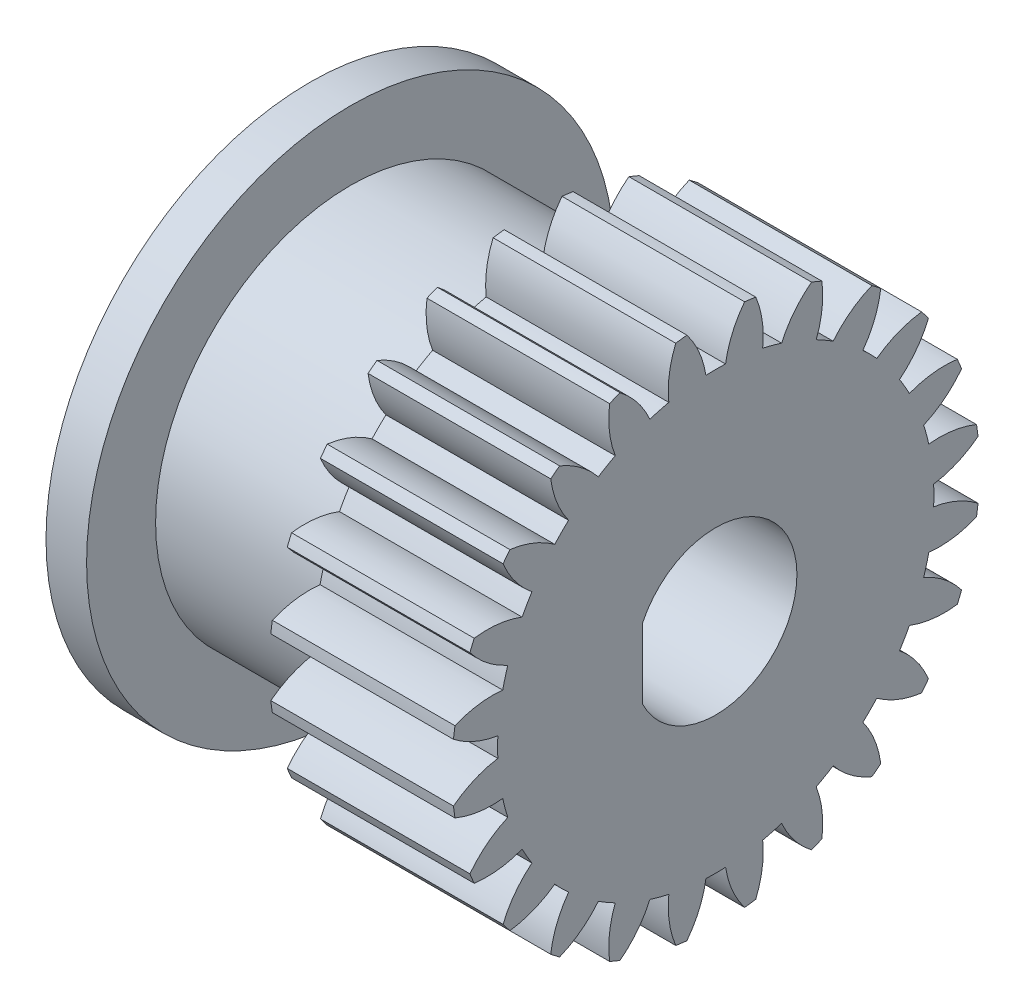
from build123d import *

# Parameters (mm, degrees)
CUT_EXTRUDE_1_REACH  = 15.583
CUT_EXTRUDE_2_REACH  = 15.583
CUT_EXTRUDE_3_REACH  = 15.583
CUT_EXTRUDE_4_REACH  = 15.583
CUT_EXTRUDE_5_REACH  = 15.583
CUT_EXTRUDE_6_REACH  = 15.583
CUT_EXTRUDE_7_REACH  = 15.583
CUT_EXTRUDE_8_REACH  = 15.583
CUT_EXTRUDE_9_REACH  = 15.583
CUT_EXTRUDE_10_REACH = 15.583
CUT_EXTRUDE_11_REACH = 15.583
CUT_EXTRUDE_12_REACH = 15.583
CUT_EXTRUDE_13_REACH = 15.583
CUT_EXTRUDE_14_REACH = 15.583
CUT_EXTRUDE_15_REACH = 15.583
CUT_EXTRUDE_16_REACH = 15.583
CUT_EXTRUDE_17_REACH = 15.583
CUT_EXTRUDE_18_REACH = 15.583
CUT_EXTRUDE_19_REACH = 15.583
CUT_EXTRUDE_20_REACH = 15.583
CUT_EXTRUDE_21_REACH = 15.583
CUT_EXTRUDE_22_REACH = 15.583
CUT_EXTRUDE_23_REACH = 15.583
CUT_EXTRUDE_24_REACH = 15.583
CUT_EXTRUDE_25_DEPTH = 14.583077707


with BuildPart() as part:
    # 草图1 → 旋转1 (revolve)
    with BuildSketch(Plane(origin=(0, 0, 0), x_dir=(-1, 0, 0), z_dir=(0, 0, -1)), mode=Mode.PRIVATE) as revolve_1_sk:
        Polygon((-4.5, 6.5), (-4.5, 0), (5.5, 0), (5.5, 6.5), (4.5, 6.5), (4.5, 4.8), (0, 4.8), (0, 6.5), align=None)
    revolve(revolve_1_sk.sketch.rotate(Axis((4.5, 0, 0), (-1, 0, 0)), 270), axis=Axis((4.5, 0, 0), (-1, 0, 0)))

    # 草图2 → 切除-拉伸1 (cut, up to next)
    with BuildSketch(Plane(origin=(4.5, 0, 0), x_dir=(0, 0, -1), z_dir=(1, 0, 0)), mode=Mode.PRIVATE) as cut_extrude_1_sk1:
        with BuildLine():
            ThreePointArc((-6.056700011, 2.359318752), (-6.278517871, 1.682323793), (-6.424915449, 0.98512003))
            ThreePointArc((-6.424915449, 0.98512003), (-5.84730165, 1.144628565), (-5.248177569, 1.156074481))
            ThreePointArc((-5.248177569, 1.156074481), (-5.19088539, 1.390893548), (-5.123092339, 1.622898915))
            ThreePointArc((-5.123092339, 1.622898915), (-5.636226055, 1.93237341), (-6.056700011, 2.359318752))
        make_face()
    cut_extrude_1_tool1 = extrude(cut_extrude_1_sk1.sketch, amount=-CUT_EXTRUDE_1_REACH, mode=Mode.PRIVATE) & part.part
    add(cut_extrude_1_tool1.solids().sort_by_distance((4.5, 1.561612, 5.828016))[0], mode=Mode.SUBTRACT)

    # 草图3 → 切除-拉伸2 (cut, up to next)
    with BuildSketch(Plane(origin=(4.5, 0, 0), x_dir=(0, 0, -1), z_dir=(1, 0, 0)), mode=Mode.PRIVATE) as cut_extrude_2_sk1:
        with BuildLine():
            ThreePointArc((-5.239686336, 3.846516229), (-5.629165125, 3.25), (-5.951023938, 2.614443361))
            ThreePointArc((-5.951023938, 2.614443361), (-5.351808006, 2.619019322), (-4.770136161, 2.475010506))
            ThreePointArc((-4.770136161, 2.475010506), (-4.65402052, 2.687), (-4.528490053, 2.893553842))
            ThreePointArc((-4.528490053, 2.893553842), (-4.944041268, 3.325292028), (-5.239686336, 3.846516229))
        make_face()
    cut_extrude_2_tool1 = extrude(cut_extrude_2_sk1.sketch, amount=-CUT_EXTRUDE_2_REACH, mode=Mode.PRIVATE) & part.part
    add(cut_extrude_2_tool1.solids().sort_by_distance((4.5, 3.016803, 5.225256))[0], mode=Mode.SUBTRACT)

    # 草图4 → 切除-拉伸3 (cut, up to next)
    with BuildSketch(Plane(origin=(4.5, 0, 0), x_dir=(0, 0, -1), z_dir=(1, 0, 0)), mode=Mode.PRIVATE) as cut_extrude_3_sk1:
        with BuildLine():
            ThreePointArc((-4.065596697, 5.071579981), (-4.596194078, 4.596194078), (-5.071579981, 4.065596697))
            ThreePointArc((-5.071579981, 4.065596697), (-4.49159749, 3.91492824), (-3.967017857, 3.625278654))
            ThreePointArc((-3.967017857, 3.625278654), (-3.799991842, 3.799991842), (-3.625278654, 3.967017857))
            ThreePointArc((-3.625278654, 3.967017857), (-3.91492824, 4.49159749), (-4.065596697, 5.071579981))
        make_face()
    cut_extrude_3_tool1 = extrude(cut_extrude_3_sk1.sketch, amount=-CUT_EXTRUDE_3_REACH, mode=Mode.PRIVATE) & part.part
    add(cut_extrude_3_tool1.solids().sort_by_distance((4.5, 4.266404, 4.266404))[0], mode=Mode.SUBTRACT)

    # 草图5 → 切除-拉伸4 (cut, up to next)
    with BuildSketch(Plane(origin=(4.5, 0, 0), x_dir=(0, 0, -1), z_dir=(1, 0, 0)), mode=Mode.PRIVATE) as cut_extrude_4_sk1:
        with BuildLine():
            ThreePointArc((-3.846516229, 5.239686336), (-3.325292028, 4.944041268), (-2.893553842, 4.528490053))
            ThreePointArc((-2.893553842, 4.528490053), (-2.687, 4.65402052), (-2.475010506, 4.770136161))
            ThreePointArc((-2.475010506, 4.770136161), (-2.619019322, 5.351808006), (-2.614443361, 5.951023938))
            ThreePointArc((-2.614443361, 5.951023938), (-3.25, 5.629165125), (-3.846516229, 5.239686336))
        make_face()
    cut_extrude_4_tool1 = extrude(cut_extrude_4_sk1.sketch, amount=-CUT_EXTRUDE_4_REACH, mode=Mode.PRIVATE) & part.part
    add(cut_extrude_4_tool1.solids().sort_by_distance((4.5, 5.225256, 3.016803))[0], mode=Mode.SUBTRACT)

    # 草图6 → 切除-拉伸5 (cut, up to next)
    with BuildSketch(Plane(origin=(4.5, 0, 0), x_dir=(0, 0, -1), z_dir=(1, 0, 0)), mode=Mode.PRIVATE) as cut_extrude_5_sk1:
        with BuildLine():
            ThreePointArc((-2.359318752, 6.056700011), (-1.93237341, 5.636226055), (-1.622898915, 5.123092339))
            ThreePointArc((-1.622898915, 5.123092339), (-1.390893548, 5.19088539), (-1.156074481, 5.248177569))
            ThreePointArc((-1.156074481, 5.248177569), (-1.144628565, 5.84730165), (-0.98512003, 6.424915449))
            ThreePointArc((-0.98512003, 6.424915449), (-1.682323793, 6.278517871), (-2.359318752, 6.056700011))
        make_face()
    cut_extrude_5_tool1 = extrude(cut_extrude_5_sk1.sketch, amount=-CUT_EXTRUDE_5_REACH, mode=Mode.PRIVATE) & part.part
    add(cut_extrude_5_tool1.solids().sort_by_distance((4.5, 5.828016, 1.561612))[0], mode=Mode.SUBTRACT)

    # 草图7 → 切除-拉伸6 (cut, up to next)
    with BuildSketch(Plane(origin=(4.5, 0, 0), x_dir=(0, 0, -1), z_dir=(1, 0, 0)), mode=Mode.PRIVATE) as cut_extrude_6_sk1:
        with BuildLine():
            ThreePointArc((0.711337602, 6.460959589), (0, 6.5), (-0.711337602, 6.460959589))
            ThreePointArc((-0.711337602, 6.460959589), (-0.407766737, 5.94431135), (-0.241646108, 5.368564348))
            ThreePointArc((-0.241646108, 5.368564348), (0, 5.374), (0.241646108, 5.368564348))
            ThreePointArc((0.241646108, 5.368564348), (0.407766737, 5.94431135), (0.711337602, 6.460959589))
        make_face()
    cut_extrude_6_tool1 = extrude(cut_extrude_6_sk1.sketch, amount=-CUT_EXTRUDE_6_REACH, mode=Mode.PRIVATE) & part.part
    add(cut_extrude_6_tool1.solids().sort_by_distance((4.5, 6.033606, 0))[0], mode=Mode.SUBTRACT)

    # 草图8 → 切除-拉伸7 (cut, up to next)
    with BuildSketch(Plane(origin=(4.5, 0, 0), x_dir=(0, 0, -1), z_dir=(1, 0, 0)), mode=Mode.PRIVATE) as cut_extrude_7_sk1:
        with BuildLine():
            ThreePointArc((2.359318752, 6.056700011), (1.682323793, 6.278517871), (0.98512003, 6.424915449))
            ThreePointArc((0.98512003, 6.424915449), (1.144628565, 5.84730165), (1.156074481, 5.248177569))
            ThreePointArc((1.156074481, 5.248177569), (1.390893548, 5.19088539), (1.622898915, 5.123092339))
            ThreePointArc((1.622898915, 5.123092339), (1.93237341, 5.636226055), (2.359318752, 6.056700011))
        make_face()
    cut_extrude_7_tool1 = extrude(cut_extrude_7_sk1.sketch, amount=-CUT_EXTRUDE_7_REACH, mode=Mode.PRIVATE) & part.part
    add(cut_extrude_7_tool1.solids().sort_by_distance((4.5, 5.828016, -1.561612))[0], mode=Mode.SUBTRACT)

    # 草图9 → 切除-拉伸8 (cut, up to next)
    with BuildSketch(Plane(origin=(4.5, 0, 0), x_dir=(0, 0, -1), z_dir=(1, 0, 0)), mode=Mode.PRIVATE) as cut_extrude_8_sk1:
        with BuildLine():
            ThreePointArc((3.846516229, 5.239686336), (3.25, 5.629165125), (2.614443361, 5.951023938))
            ThreePointArc((2.614443361, 5.951023938), (2.619019322, 5.351808006), (2.475010506, 4.770136161))
            ThreePointArc((2.475010506, 4.770136161), (2.687, 4.65402052), (2.893553842, 4.528490053))
            ThreePointArc((2.893553842, 4.528490053), (3.325292028, 4.944041268), (3.846516229, 5.239686336))
        make_face()
    cut_extrude_8_tool1 = extrude(cut_extrude_8_sk1.sketch, amount=-CUT_EXTRUDE_8_REACH, mode=Mode.PRIVATE) & part.part
    add(cut_extrude_8_tool1.solids().sort_by_distance((4.5, 5.225256, -3.016803))[0], mode=Mode.SUBTRACT)

    # 草图10 → 切除-拉伸9 (cut, up to next)
    with BuildSketch(Plane(origin=(4.5, 0, 0), x_dir=(0, 0, -1), z_dir=(1, 0, 0)), mode=Mode.PRIVATE) as cut_extrude_9_sk1:
        with BuildLine():
            ThreePointArc((5.071579981, 4.065596697), (4.596194078, 4.596194078), (4.065596697, 5.071579981))
            ThreePointArc((4.065596697, 5.071579981), (3.91492824, 4.49159749), (3.625278654, 3.967017857))
            ThreePointArc((3.625278654, 3.967017857), (3.799991842, 3.799991842), (3.967017857, 3.625278654))
            ThreePointArc((3.967017857, 3.625278654), (4.49159749, 3.91492824), (5.071579981, 4.065596697))
        make_face()
    cut_extrude_9_tool1 = extrude(cut_extrude_9_sk1.sketch, amount=-CUT_EXTRUDE_9_REACH, mode=Mode.PRIVATE) & part.part
    add(cut_extrude_9_tool1.solids().sort_by_distance((4.5, 4.266404, -4.266404))[0], mode=Mode.SUBTRACT)

    # 草图11 → 切除-拉伸10 (cut, up to next)
    with BuildSketch(Plane(origin=(4.5, 0, 0), x_dir=(0, 0, -1), z_dir=(1, 0, 0)), mode=Mode.PRIVATE) as cut_extrude_10_sk1:
        with BuildLine():
            ThreePointArc((5.951023938, 2.614443361), (5.629165125, 3.25), (5.239686336, 3.846516229))
            ThreePointArc((5.239686336, 3.846516229), (4.944041268, 3.325292028), (4.528490053, 2.893553842))
            ThreePointArc((4.528490053, 2.893553842), (4.65402052, 2.687), (4.770136161, 2.475010506))
            ThreePointArc((4.770136161, 2.475010506), (5.351808006, 2.619019322), (5.951023938, 2.614443361))
        make_face()
    cut_extrude_10_tool1 = extrude(cut_extrude_10_sk1.sketch, amount=-CUT_EXTRUDE_10_REACH, mode=Mode.PRIVATE) & part.part
    add(cut_extrude_10_tool1.solids().sort_by_distance((4.5, 3.016803, -5.225256))[0], mode=Mode.SUBTRACT)

    # 草图12 → 切除-拉伸11 (cut, up to next)
    with BuildSketch(Plane(origin=(4.5, 0, 0), x_dir=(0, 0, -1), z_dir=(1, 0, 0)), mode=Mode.PRIVATE) as cut_extrude_11_sk1:
        with BuildLine():
            ThreePointArc((6.424915449, 0.98512003), (6.278517871, 1.682323793), (6.056700011, 2.359318752))
            ThreePointArc((6.056700011, 2.359318752), (5.636226055, 1.93237341), (5.123092339, 1.622898915))
            ThreePointArc((5.123092339, 1.622898915), (5.19088539, 1.390893548), (5.248177569, 1.156074481))
            ThreePointArc((5.248177569, 1.156074481), (5.84730165, 1.144628565), (6.424915449, 0.98512003))
        make_face()
    cut_extrude_11_tool1 = extrude(cut_extrude_11_sk1.sketch, amount=-CUT_EXTRUDE_11_REACH, mode=Mode.PRIVATE) & part.part
    add(cut_extrude_11_tool1.solids().sort_by_distance((4.5, 1.561612, -5.828016))[0], mode=Mode.SUBTRACT)

    # 草图13 → 切除-拉伸12 (cut, up to next)
    with BuildSketch(Plane(origin=(4.5, 0, 0), x_dir=(0, 0, -1), z_dir=(1, 0, 0)), mode=Mode.PRIVATE) as cut_extrude_12_sk1:
        with BuildLine():
            ThreePointArc((6.460959589, -0.711337602), (6.5, 0), (6.460959589, 0.711337602))
            ThreePointArc((6.460959589, 0.711337602), (5.94431135, 0.407766737), (5.368564348, 0.241646108))
            ThreePointArc((5.368564348, 0.241646108), (5.374, 0), (5.368564348, -0.241646108))
            ThreePointArc((5.368564348, -0.241646108), (5.94431135, -0.407766737), (6.460959589, -0.711337602))
        make_face()
    cut_extrude_12_tool1 = extrude(cut_extrude_12_sk1.sketch, amount=-CUT_EXTRUDE_12_REACH, mode=Mode.PRIVATE) & part.part
    add(cut_extrude_12_tool1.solids().sort_by_distance((4.5, 0, -6.033606))[0], mode=Mode.SUBTRACT)

    # 草图14 → 切除-拉伸13 (cut, up to next)
    with BuildSketch(Plane(origin=(4.5, 0, 0), x_dir=(0, 0, -1), z_dir=(1, 0, 0)), mode=Mode.PRIVATE) as cut_extrude_13_sk1:
        with BuildLine():
            ThreePointArc((6.056700011, -2.359318752), (6.278517871, -1.682323793), (6.424915449, -0.98512003))
            ThreePointArc((6.424915449, -0.98512003), (5.84730165, -1.144628565), (5.248177569, -1.156074481))
            ThreePointArc((5.248177569, -1.156074481), (5.19088539, -1.390893548), (5.123092339, -1.622898915))
            ThreePointArc((5.123092339, -1.622898915), (5.636226055, -1.93237341), (6.056700011, -2.359318752))
        make_face()
    cut_extrude_13_tool1 = extrude(cut_extrude_13_sk1.sketch, amount=-CUT_EXTRUDE_13_REACH, mode=Mode.PRIVATE) & part.part
    add(cut_extrude_13_tool1.solids().sort_by_distance((4.5, -1.561612, -5.828016))[0], mode=Mode.SUBTRACT)

    # 草图15 → 切除-拉伸14 (cut, up to next)
    with BuildSketch(Plane(origin=(4.5, 0, 0), x_dir=(0, 0, -1), z_dir=(1, 0, 0)), mode=Mode.PRIVATE) as cut_extrude_14_sk1:
        with BuildLine():
            ThreePointArc((5.239686336, -3.846516229), (5.629165125, -3.25), (5.951023938, -2.614443361))
            ThreePointArc((5.951023938, -2.614443361), (5.351808006, -2.619019322), (4.770136161, -2.475010506))
            ThreePointArc((4.770136161, -2.475010506), (4.65402052, -2.687), (4.528490053, -2.893553842))
            ThreePointArc((4.528490053, -2.893553842), (4.944041268, -3.325292028), (5.239686336, -3.846516229))
        make_face()
    cut_extrude_14_tool1 = extrude(cut_extrude_14_sk1.sketch, amount=-CUT_EXTRUDE_14_REACH, mode=Mode.PRIVATE) & part.part
    add(cut_extrude_14_tool1.solids().sort_by_distance((4.5, -3.016803, -5.225256))[0], mode=Mode.SUBTRACT)

    # 草图16 → 切除-拉伸15 (cut, up to next)
    with BuildSketch(Plane(origin=(4.5, 0, 0), x_dir=(0, 0, -1), z_dir=(1, 0, 0)), mode=Mode.PRIVATE) as cut_extrude_15_sk1:
        with BuildLine():
            ThreePointArc((4.065596697, -5.071579981), (4.596194078, -4.596194078), (5.071579981, -4.065596697))
            ThreePointArc((5.071579981, -4.065596697), (4.49159749, -3.91492824), (3.967017857, -3.625278654))
            ThreePointArc((3.967017857, -3.625278654), (3.799991842, -3.799991842), (3.625278654, -3.967017857))
            ThreePointArc((3.625278654, -3.967017857), (3.91492824, -4.49159749), (4.065596697, -5.071579981))
        make_face()
    cut_extrude_15_tool1 = extrude(cut_extrude_15_sk1.sketch, amount=-CUT_EXTRUDE_15_REACH, mode=Mode.PRIVATE) & part.part
    add(cut_extrude_15_tool1.solids().sort_by_distance((4.5, -4.266404, -4.266404))[0], mode=Mode.SUBTRACT)

    # 草图17 → 切除-拉伸16 (cut, up to next)
    with BuildSketch(Plane(origin=(4.5, 0, 0), x_dir=(0, 0, -1), z_dir=(1, 0, 0)), mode=Mode.PRIVATE) as cut_extrude_16_sk1:
        with BuildLine():
            ThreePointArc((2.614443361, -5.951023938), (3.25, -5.629165125), (3.846516229, -5.239686336))
            ThreePointArc((3.846516229, -5.239686336), (3.325292028, -4.944041268), (2.893553842, -4.528490053))
            ThreePointArc((2.893553842, -4.528490053), (2.687, -4.65402052), (2.475010506, -4.770136161))
            ThreePointArc((2.475010506, -4.770136161), (2.619019322, -5.351808006), (2.614443361, -5.951023938))
        make_face()
    cut_extrude_16_tool1 = extrude(cut_extrude_16_sk1.sketch, amount=-CUT_EXTRUDE_16_REACH, mode=Mode.PRIVATE) & part.part
    add(cut_extrude_16_tool1.solids().sort_by_distance((4.5, -5.225256, -3.016803))[0], mode=Mode.SUBTRACT)

    # 草图18 → 切除-拉伸17 (cut, up to next)
    with BuildSketch(Plane(origin=(4.5, 0, 0), x_dir=(0, 0, -1), z_dir=(1, 0, 0)), mode=Mode.PRIVATE) as cut_extrude_17_sk1:
        with BuildLine():
            ThreePointArc((0.98512003, -6.424915449), (1.682323793, -6.278517871), (2.359318752, -6.056700011))
            ThreePointArc((2.359318752, -6.056700011), (1.93237341, -5.636226055), (1.622898915, -5.123092339))
            ThreePointArc((1.622898915, -5.123092339), (1.390893548, -5.19088539), (1.156074481, -5.248177569))
            ThreePointArc((1.156074481, -5.248177569), (1.144628565, -5.84730165), (0.98512003, -6.424915449))
        make_face()
    cut_extrude_17_tool1 = extrude(cut_extrude_17_sk1.sketch, amount=-CUT_EXTRUDE_17_REACH, mode=Mode.PRIVATE) & part.part
    add(cut_extrude_17_tool1.solids().sort_by_distance((4.5, -5.828016, -1.561612))[0], mode=Mode.SUBTRACT)

    # 草图19 → 切除-拉伸18 (cut, up to next)
    with BuildSketch(Plane(origin=(4.5, 0, 0), x_dir=(0, 0, -1), z_dir=(1, 0, 0)), mode=Mode.PRIVATE) as cut_extrude_18_sk1:
        with BuildLine():
            ThreePointArc((-0.711337602, -6.460959589), (0, -6.5), (0.711337602, -6.460959589))
            ThreePointArc((0.711337602, -6.460959589), (0.407766737, -5.94431135), (0.241646108, -5.368564348))
            ThreePointArc((0.241646108, -5.368564348), (0, -5.374), (-0.241646108, -5.368564348))
            ThreePointArc((-0.241646108, -5.368564348), (-0.407766737, -5.94431135), (-0.711337602, -6.460959589))
        make_face()
    cut_extrude_18_tool1 = extrude(cut_extrude_18_sk1.sketch, amount=-CUT_EXTRUDE_18_REACH, mode=Mode.PRIVATE) & part.part
    add(cut_extrude_18_tool1.solids().sort_by_distance((4.5, -6.033606, 0))[0], mode=Mode.SUBTRACT)

    # 草图20 → 切除-拉伸19 (cut, up to next)
    with BuildSketch(Plane(origin=(4.5, 0, 0), x_dir=(0, 0, -1), z_dir=(1, 0, 0)), mode=Mode.PRIVATE) as cut_extrude_19_sk1:
        with BuildLine():
            ThreePointArc((-2.359318752, -6.056700011), (-1.682323793, -6.278517871), (-0.98512003, -6.424915449))
            ThreePointArc((-0.98512003, -6.424915449), (-1.144628565, -5.84730165), (-1.156074481, -5.248177569))
            ThreePointArc((-1.156074481, -5.248177569), (-1.390893548, -5.19088539), (-1.622898915, -5.123092339))
            ThreePointArc((-1.622898915, -5.123092339), (-1.93237341, -5.636226055), (-2.359318752, -6.056700011))
        make_face()
    cut_extrude_19_tool1 = extrude(cut_extrude_19_sk1.sketch, amount=-CUT_EXTRUDE_19_REACH, mode=Mode.PRIVATE) & part.part
    add(cut_extrude_19_tool1.solids().sort_by_distance((4.5, -5.828016, 1.561612))[0], mode=Mode.SUBTRACT)

    # 草图21 → 切除-拉伸20 (cut, up to next)
    with BuildSketch(Plane(origin=(4.5, 0, 0), x_dir=(0, 0, -1), z_dir=(1, 0, 0)), mode=Mode.PRIVATE) as cut_extrude_20_sk1:
        with BuildLine():
            ThreePointArc((-3.846516229, -5.239686336), (-3.25, -5.629165125), (-2.614443361, -5.951023938))
            ThreePointArc((-2.614443361, -5.951023938), (-2.619019322, -5.351808006), (-2.475010506, -4.770136161))
            ThreePointArc((-2.475010506, -4.770136161), (-2.687, -4.65402052), (-2.893553842, -4.528490053))
            ThreePointArc((-2.893553842, -4.528490053), (-3.325292028, -4.944041268), (-3.846516229, -5.239686336))
        make_face()
    cut_extrude_20_tool1 = extrude(cut_extrude_20_sk1.sketch, amount=-CUT_EXTRUDE_20_REACH, mode=Mode.PRIVATE) & part.part
    add(cut_extrude_20_tool1.solids().sort_by_distance((4.5, -5.225256, 3.016803))[0], mode=Mode.SUBTRACT)

    # 草图22 → 切除-拉伸21 (cut, up to next)
    with BuildSketch(Plane(origin=(4.5, 0, 0), x_dir=(0, 0, -1), z_dir=(1, 0, 0)), mode=Mode.PRIVATE) as cut_extrude_21_sk1:
        with BuildLine():
            ThreePointArc((-5.071579981, -4.065596697), (-4.596194078, -4.596194078), (-4.065596697, -5.071579981))
            ThreePointArc((-4.065596697, -5.071579981), (-3.91492824, -4.49159749), (-3.625278654, -3.967017857))
            ThreePointArc((-3.625278654, -3.967017857), (-3.799991842, -3.799991842), (-3.967017857, -3.625278654))
            ThreePointArc((-3.967017857, -3.625278654), (-4.49159749, -3.91492824), (-5.071579981, -4.065596697))
        make_face()
    cut_extrude_21_tool1 = extrude(cut_extrude_21_sk1.sketch, amount=-CUT_EXTRUDE_21_REACH, mode=Mode.PRIVATE) & part.part
    add(cut_extrude_21_tool1.solids().sort_by_distance((4.5, -4.266404, 4.266404))[0], mode=Mode.SUBTRACT)

    # 草图23 → 切除-拉伸22 (cut, up to next)
    with BuildSketch(Plane(origin=(4.5, 0, 0), x_dir=(0, 0, -1), z_dir=(1, 0, 0)), mode=Mode.PRIVATE) as cut_extrude_22_sk1:
        with BuildLine():
            ThreePointArc((-5.951023938, -2.614443361), (-5.629165125, -3.25), (-5.239686336, -3.846516229))
            ThreePointArc((-5.239686336, -3.846516229), (-4.944041268, -3.325292028), (-4.528490053, -2.893553842))
            ThreePointArc((-4.528490053, -2.893553842), (-4.65402052, -2.687), (-4.770136161, -2.475010506))
            ThreePointArc((-4.770136161, -2.475010506), (-5.351808006, -2.619019322), (-5.951023938, -2.614443361))
        make_face()
    cut_extrude_22_tool1 = extrude(cut_extrude_22_sk1.sketch, amount=-CUT_EXTRUDE_22_REACH, mode=Mode.PRIVATE) & part.part
    add(cut_extrude_22_tool1.solids().sort_by_distance((4.5, -3.016803, 5.225256))[0], mode=Mode.SUBTRACT)

    # 草图24 → 切除-拉伸23 (cut, up to next)
    with BuildSketch(Plane(origin=(4.5, 0, 0), x_dir=(0, 0, -1), z_dir=(1, 0, 0)), mode=Mode.PRIVATE) as cut_extrude_23_sk1:
        with BuildLine():
            ThreePointArc((-6.424915449, -0.98512003), (-6.278517871, -1.682323793), (-6.056700011, -2.359318752))
            ThreePointArc((-6.056700011, -2.359318752), (-5.636226055, -1.93237341), (-5.123092339, -1.622898915))
            ThreePointArc((-5.123092339, -1.622898915), (-5.19088539, -1.390893548), (-5.248177569, -1.156074481))
            ThreePointArc((-5.248177569, -1.156074481), (-5.84730165, -1.144628565), (-6.424915449, -0.98512003))
        make_face()
    cut_extrude_23_tool1 = extrude(cut_extrude_23_sk1.sketch, amount=-CUT_EXTRUDE_23_REACH, mode=Mode.PRIVATE) & part.part
    add(cut_extrude_23_tool1.solids().sort_by_distance((4.5, -1.561612, 5.828016))[0], mode=Mode.SUBTRACT)

    # 草图25 → 切除-拉伸24 (cut, up to next)
    with BuildSketch(Plane(origin=(4.5, 0, 0), x_dir=(0, 0, -1), z_dir=(1, 0, 0)), mode=Mode.PRIVATE) as cut_extrude_24_sk1:
        with BuildLine():
            ThreePointArc((-6.460959589, 0.711337602), (-6.5, 0), (-6.460959589, -0.711337602))
            ThreePointArc((-6.460959589, -0.711337602), (-5.94431135, -0.407766737), (-5.368564348, -0.241646108))
            ThreePointArc((-5.368564348, -0.241646108), (-5.374, 0), (-5.368564348, 0.241646108))
            ThreePointArc((-5.368564348, 0.241646108), (-5.94431135, 0.407766737), (-6.460959589, 0.711337602))
        make_face()
    cut_extrude_24_tool1 = extrude(cut_extrude_24_sk1.sketch, amount=-CUT_EXTRUDE_24_REACH, mode=Mode.PRIVATE) & part.part
    add(cut_extrude_24_tool1.solids().sort_by_distance((4.5, 0, 6.033606))[0], mode=Mode.SUBTRACT)

    # 草图26 → 切除-拉伸25 (cut, through all)
    with BuildSketch(Plane.ZY.offset(5.5)):
        with BuildLine():
            Line((1.8, -0.871779789), (1.8, 0.871779789))
            ThreePointArc((1.8, 0.871779789), (-2, 0), (1.8, -0.871779789))
        make_face()
    extrude(amount=-CUT_EXTRUDE_25_DEPTH, mode=Mode.SUBTRACT)


solid = part.part
